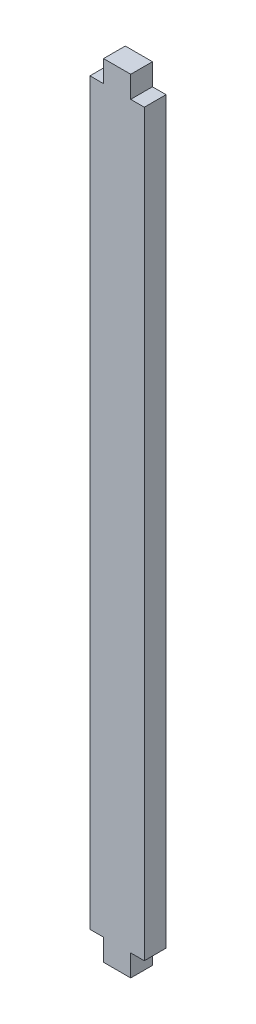
from build123d import *

# Parameters (mm, degrees)
SKETCH2_W           = 12.7
SKETCH2_H           = 182.88
BOSS_EXTRUDE1_DEPTH = 5.08
SKETCH3_W           = 3.175
SKETCH3_H           = 5.08
CUT_EXTRUDE1_DEPTH  = 184.390814383


with BuildPart() as part:
    # Sketch2 → Boss-Extrude1 (new body)
    with BuildSketch(Plane.XY):
        with Locations((6.35, 91.44)):
            Rectangle(SKETCH2_W, SKETCH2_H)
    extrude(amount=BOSS_EXTRUDE1_DEPTH)

    # Sketch3 → Cut-Extrude1 (cut, through all)
    with BuildSketch(Plane.XY.offset(5.08)):
        with Locations((1.5875, 180.34)):
            Rectangle(SKETCH3_W, SKETCH3_H)
        with Locations((11.1125, 180.34)):
            Rectangle(SKETCH3_W, SKETCH3_H)
        with Locations((1.5875, 2.54)):
            Rectangle(SKETCH3_W, SKETCH3_H)
        with Locations((11.1125, 2.54)):
            Rectangle(SKETCH3_W, SKETCH3_H)
    extrude(amount=-CUT_EXTRUDE1_DEPTH, mode=Mode.SUBTRACT)


solid = part.part
